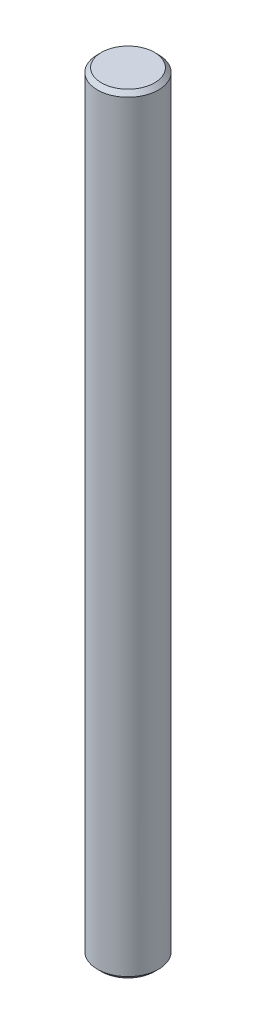
from build123d import *

# Parameters (mm, degrees)
SKETCH1_W          = 7.5
SKETCH1_H          = 189
SKETCH2_W          = 3
SKETCH2_H          = 3
CUT_EXTRUDE1_DEPTH = 18
SKETCH3_W          = 3
SKETCH3_H          = 3
CUT_EXTRUDE2_DEPTH = 15
CHAMFER1_SIZE      = 1


with BuildPart() as part:
    # Sketch1 → Revolve1 (revolve)
    with BuildSketch(Plane.XY, mode=Mode.PRIVATE) as revolve1_sk:
        with Locations((3.75, 94.5)):
            Rectangle(SKETCH1_W, SKETCH1_H)
    revolve(revolve1_sk.sketch.rotate(Axis((0, 189, 0), (0, -1, 0)), 180), axis=Axis((0, 189, 0), (0, -1, 0)))

    # Sketch2 → Cut-Extrude1 (cut)
    with BuildSketch(Plane(origin=(0, 169, 0), x_dir=(1, 0, 0), z_dir=(0, 1, 0))):
        with Locations((0, 7.5)):
            Rectangle(SKETCH2_W, SKETCH2_H)
    extrude(amount=-CUT_EXTRUDE1_DEPTH, mode=Mode.SUBTRACT)

    # Sketch3 → Cut-Extrude2 (cut)
    with BuildSketch(Plane(origin=(0, 104, 0), x_dir=(-1, 0, 0), z_dir=(0, -1, 0))):
        with Locations((0, 7.5)):
            Rectangle(SKETCH3_W, SKETCH3_H)
    extrude(amount=CUT_EXTRUDE2_DEPTH, mode=Mode.SUBTRACT)

    # Chamfer1
    chamfer1_edges = [part.edges().sort_by_distance(p)[0] for p in [
        (7.5, 0, 0),
        (7.5, 189, 0),
    ]]
    chamfer(chamfer1_edges, length=CHAMFER1_SIZE)


solid = part.part
